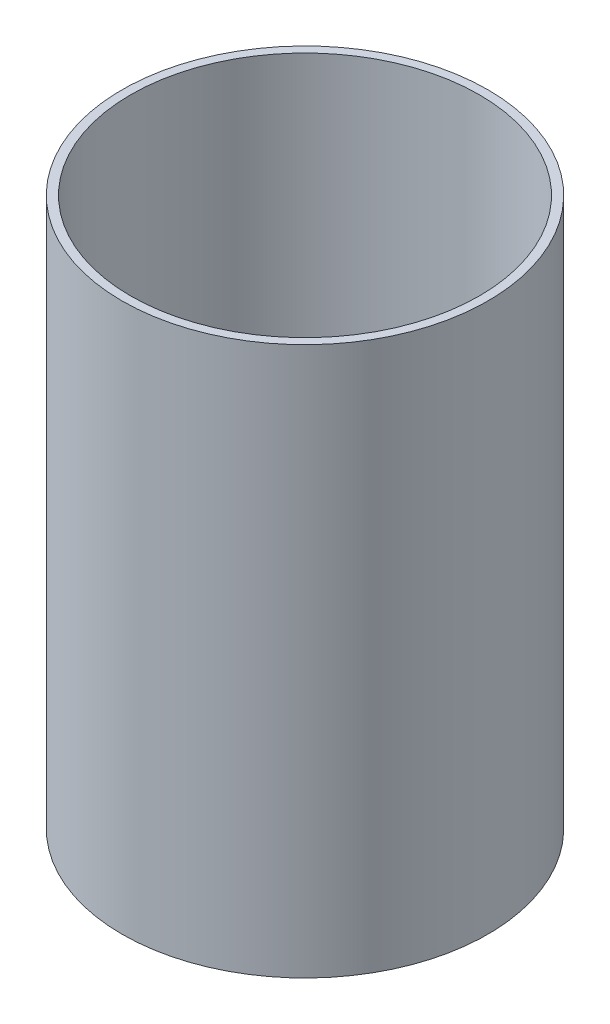
from build123d import *

# Parameters (mm, degrees)
SKETCH1_R           = 85
SKETCH1_R_2         = 81
BOSS_EXTRUDE1_DEPTH = 254.85


with BuildPart() as part:
    # Sketch1 → Boss-Extrude1 (new body)
    with BuildSketch(Plane(origin=(0, 0, 0), x_dir=(1, 0, 0), z_dir=(0, 1, 0))):
        with Locations(Location((0, 0, 0), (0, 0, 270))):
            Circle(SKETCH1_R)
        with Locations(Location((0, 0, 0), (0, 0, 270))):
            Circle(SKETCH1_R_2, mode=Mode.SUBTRACT)
    extrude(amount=BOSS_EXTRUDE1_DEPTH)


solid = part.part
